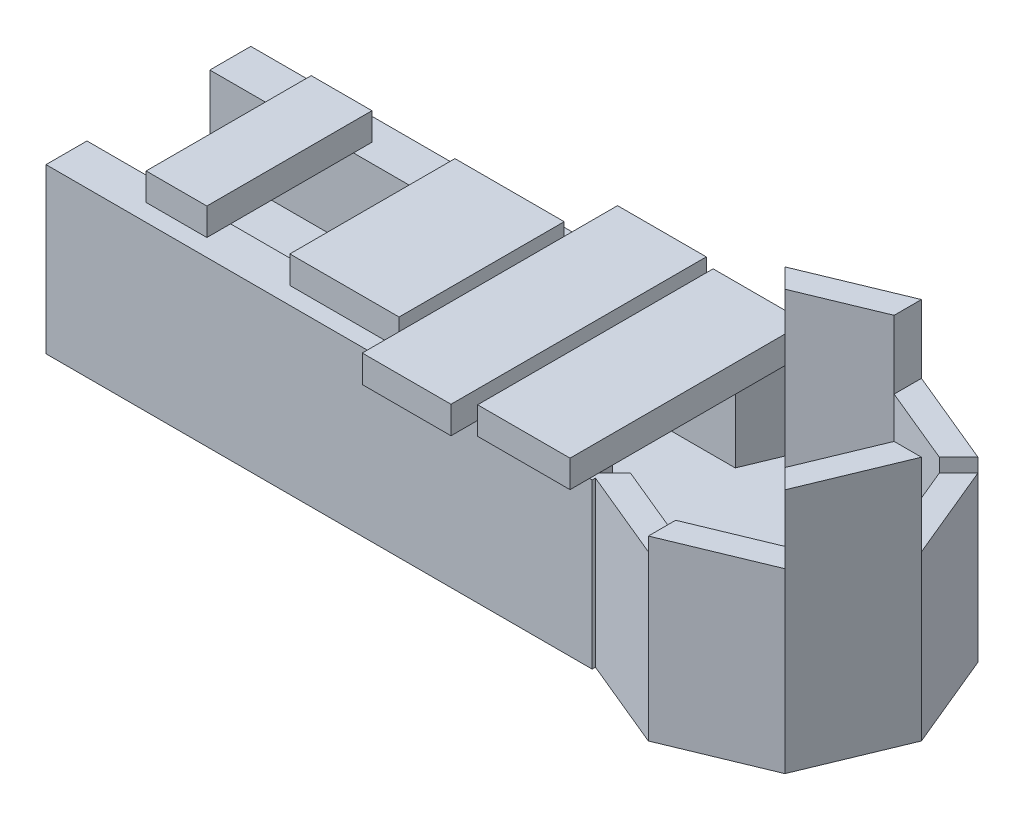
from build123d import *

# Parameters (mm, degrees)
SALIENTE_EXTRUIR1_DEPTH   = 3
SALIENTE_EXTRUIR1_2_DEPTH = 3
SALIENTE_EXTRUIR2_DEPTH   = 6
SALIENTE_EXTRUIR2_2_DEPTH = 6
SALIENTE_EXTRUIR3_DEPTH   = 3.5
SALIENTE_EXTRUIR3_2_DEPTH = 3.5
SALIENTE_EXTRUIR4_DEPTH   = 3
SALIENTE_EXTRUIR4_2_DEPTH = 3
SALIENTE_EXTRUIR5_DEPTH   = 3
CROQUIS3_R                = 1.575
CORTAR_EXTRUIR1_DEPTH     = 2.5
CROQUIS4_W                = 3.383823373
CROQUIS4_H                = 8.6242578
CROQUIS4_W_2              = 3.249859327
CROQUIS4_H_2              = 9.348028676
CROQUIS4_W_3              = 4.000427531
CROQUIS4_H_3              = 6.045673659
CROQUIS4_W_4              = 2.224540958
SALIENTE_EXTRUIR6_DEPTH   = 1


with BuildPart() as part:
    # Croquis1 → Saliente-Extruir1 (new body)
    with BuildSketch(Plane(origin=(0, 0, 0), x_dir=(1, 0, 0), z_dir=(0, 1, 0))):
        Polygon((-10, -2.25), (-10, -3.75), (10, -3.75), (10, -3.630117405), (9.771655233, -3.535533906), (9.239169654, -2.25), align=None)
    extrude(amount=SALIENTE_EXTRUIR1_DEPTH)



with BuildPart() as body_2:
    # Croquis1 → Saliente-Extruir1 2 (new body)
    with BuildSketch(Plane(origin=(0, 0, 0), x_dir=(1, 0, 0), z_dir=(0, 1, 0))):
        Polygon((-10, 3.75), (-10, 2.25), (9.239169654, 2.25), (9.771655233, 3.535533906), (10, 3.630117405), (10, 3.75), align=None)
    extrude(amount=SALIENTE_EXTRUIR1_2_DEPTH)


with BuildPart() as body_3:
    # Croquis1<3> → Saliente-Extruir2 (new body)
    with BuildSketch(Plane(origin=(0, 0, 0), x_dir=(1, 0, 0), z_dir=(0, 1, 0))):
        Polygon((16.135616264, -2.828427125), (16.842723045, -3.535533906), (18.307189139, 0), (17.307189139, 0), align=None)
    extrude(amount=SALIENTE_EXTRUIR2_DEPTH)


with BuildPart() as body_4:
    # Croquis1<3> → Saliente-Extruir2 2 (new body)
    with BuildSketch(Plane(origin=(0, 0, 0), x_dir=(1, 0, 0), z_dir=(0, 1, 0))):
        Polygon((9.771655233, 3.535533906), (10.478762014, 2.828427125), (13.307189139, 4), (13.307189139, 5), align=None)
    extrude(amount=SALIENTE_EXTRUIR2_2_DEPTH)


with BuildPart() as body_5:
    # Croquis1<4> → Saliente-Extruir3 (new body)
    with BuildSketch(Plane(origin=(0, 0, 0), x_dir=(1, 0, 0), z_dir=(0, 1, 0))):
        Polygon((13.307189139, -4), (13.307189139, -5), (16.842723045, -3.535533906), (16.135616264, -2.828427125), align=None)
    extrude(amount=SALIENTE_EXTRUIR3_DEPTH)


with BuildPart() as body_6:
    # Croquis1<4> → Saliente-Extruir3 2 (new body)
    with BuildSketch(Plane(origin=(0, 0, 0), x_dir=(1, 0, 0), z_dir=(0, 1, 0))):
        Polygon((16.135616264, 2.828427125), (16.842723045, 3.535533906), (13.307189139, 5), (13.307189139, 4), align=None)
    extrude(amount=SALIENTE_EXTRUIR3_2_DEPTH)


with BuildPart() as body_7:
    # Croquis1<5> → Saliente-Extruir4 (new body)
    with BuildSketch(Plane(origin=(0, 0, 0), x_dir=(1, 0, 0), z_dir=(0, 1, 0))):
        Polygon((9.771655233, -3.535533906), (13.307189139, -5), (13.307189139, -4), (10.478762014, -2.828427125), align=None)
    extrude(amount=SALIENTE_EXTRUIR4_DEPTH)


with BuildPart() as body_8:
    # Croquis1<5> → Saliente-Extruir4 2 (new body)
    with BuildSketch(Plane(origin=(0, 0, 0), x_dir=(1, 0, 0), z_dir=(0, 1, 0))):
        Polygon((17.307189139, 0), (18.307189139, 0), (16.842723045, 3.535533906), (16.135616264, 2.828427125), align=None)
    extrude(amount=SALIENTE_EXTRUIR4_2_DEPTH)


with BuildPart() as part_1:
    add(part.part)

    add(body_2.part)  # Saliente-Extruir5 merges body 2

    add(body_3.part)  # Saliente-Extruir5 merges body 3

    add(body_4.part)  # Saliente-Extruir5 merges body 4

    add(body_5.part)  # Saliente-Extruir5 merges body 5

    add(body_6.part)  # Saliente-Extruir5 merges body 6

    add(body_7.part)  # Saliente-Extruir5 merges body 7

    add(body_8.part)  # Saliente-Extruir5 merges body 8
    # Croquis2 → Saliente-Extruir5 (add)
    with BuildSketch(Plane.XZ):
        Polygon((10, 3.75), (-10, 3.75), (-10, -3.75), (10, -3.75), (10, -3.630117405), (13.307189139, -5), (16.842723045, -3.535533906), (18.307189139, 0), (16.842723045, 3.535533906), (13.307189139, 5), (10, 3.630117405), align=None)
    extrude(amount=SALIENTE_EXTRUIR5_DEPTH)

    # Croquis3 → Cortar-Extruir1 (cut)
    with BuildSketch(Plane.XZ.offset(3)):
        with Locations((4.333266607, 0)):
            Circle(CROQUIS3_R)
    extrude(amount=-CORTAR_EXTRUIR1_DEPTH, mode=Mode.SUBTRACT)

    # Croquis4 → Saliente-Extruir6 (add)
    with BuildSketch(Plane(origin=(0, 3, 0), x_dir=(1, 0, 0), z_dir=(0, 1, 0))):
        with Locations((8.211188083, -0.151851299)):
            Rectangle(CROQUIS4_W, CROQUIS4_H)
        with Locations((4.390228963, -0.260399993)):
            Rectangle(CROQUIS4_W_2, CROQUIS4_H_2)
        with Locations((0.297050365, -0.094855663)):
            Rectangle(CROQUIS4_W_3, CROQUIS4_H_3)
        with Locations((-5.85391415, -0.094855663)):
            Rectangle(CROQUIS4_W_4, CROQUIS4_H_3)
    extrude(amount=SALIENTE_EXTRUIR6_DEPTH)


solid = part_1.part
